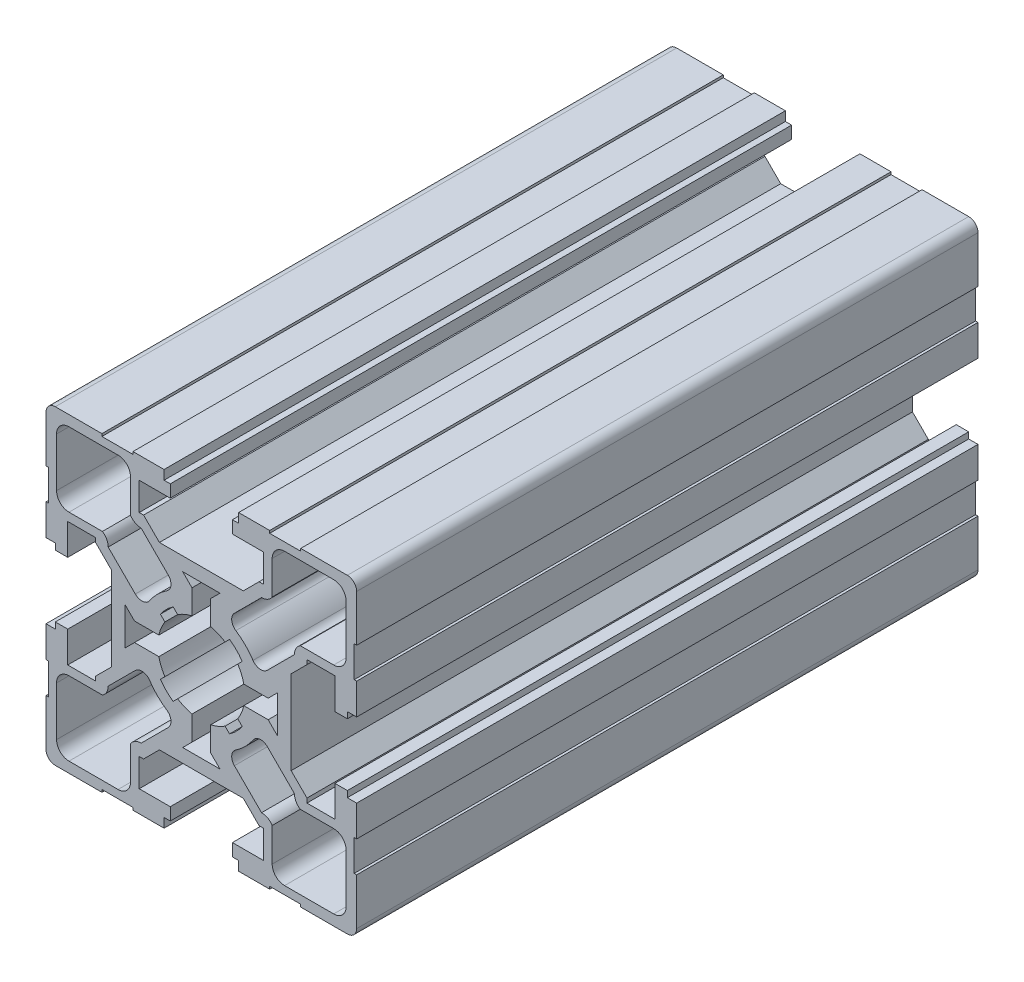
from build123d import *

# Parameters (mm, degrees)
EXTRUDE_1_DEPTH = 100


with BuildPart() as part:
    # 草图1 → 凸台-拉伸1 (new body)
    with BuildSketch(Plane.XY):
        with BuildLine():
            Line((-5.877197952, 24.545792426), (-10.877197952, 24.545792426))
            Line((-10.877197952, 24.545792426), (-10.877197952, 24.145792426))
            Line((-10.877197952, 24.145792426), (-15.877197952, 24.145792426))
            Line((-15.877197952, 24.145792426), (-15.877197952, 24.545792426))
            Line((-15.877197952, 24.545792426), (-23.377197952, 24.545792426))
            ThreePointArc((-23.377197952, 24.545792426), (-24.437858124, 24.106452598), (-24.877197952, 23.045792426))
            Line((-24.877197952, 23.045792426), (-24.877197952, 15.545792426))
            Line((-24.877197952, 15.545792426), (-24.477197952, 15.545792426))
            Line((-24.477197952, 15.545792426), (-24.477197952, 10.545792426))
            Line((-24.477197952, 10.545792426), (-24.877197952, 10.545792426))
            Line((-24.877197952, 10.545792426), (-24.877197952, 5.545792426))
            Line((-24.877197952, 5.545792426), (-23.377197952, 5.545792426))
            Line((-23.377197952, 5.545792426), (-23.377197952, 4.545792426))
            Line((-23.377197952, 4.545792426), (-21.377197952, 4.545792426))
            Line((-21.377197952, 4.545792426), (-21.377197952, 9.545792426))
            Line((-21.377197952, 9.545792426), (-16.877197952, 9.545792426))
            Line((-16.877197952, 9.545792426), (-16.877197952, 8.84162937))
            Line((-16.877197952, 8.84162937), (-14.331361008, 6.295792426))
            Line((-14.331361008, 6.295792426), (-14.331361008, -0.454207574))
            Line((-14.331361008, -0.454207574), (-14.331361008, -7.204207574))
            Line((-14.331361008, -7.204207574), (-16.877197952, -9.750044518))
            Line((-16.877197952, -9.750044518), (-16.877197952, -10.454207574))
            Line((-16.877197952, -10.454207574), (-21.377197952, -10.454207574))
            Line((-21.377197952, -10.454207574), (-21.377197952, -5.454207574))
            Line((-21.377197952, -5.454207574), (-23.377197952, -5.454207574))
            Line((-23.377197952, -5.454207574), (-23.377197952, -6.454207574))
            Line((-23.377197952, -6.454207574), (-24.877197952, -6.454207574))
            Line((-24.877197952, -6.454207574), (-24.877197952, -11.454207574))
            Line((-24.877197952, -11.454207574), (-24.477197952, -11.454207574))
            Line((-24.477197952, -11.454207574), (-24.477197952, -16.454207574))
            Line((-24.477197952, -16.454207574), (-24.877197952, -16.454207574))
            Line((-24.877197952, -16.454207574), (-24.877197952, -23.954207574))
            ThreePointArc((-24.877197952, -23.954207574), (-24.437858124, -25.014867745), (-23.377197952, -25.454207574))
            Line((-23.377197952, -25.454207574), (-15.877197952, -25.454207574))
            Line((-15.877197952, -25.454207574), (-15.877197952, -25.054207574))
            Line((-15.877197952, -25.054207574), (-10.877197952, -25.054207574))
            Line((-10.877197952, -25.054207574), (-10.877197952, -25.454207574))
            Line((-10.877197952, -25.454207574), (-5.877197952, -25.454207574))
            Line((-5.877197952, -25.454207574), (-5.877197952, -23.954207574))
            Line((-5.877197952, -23.954207574), (-4.877197952, -23.954207574))
            Line((-4.877197952, -23.954207574), (-4.877197952, -21.954207574))
            Line((-4.877197952, -21.954207574), (-9.877197952, -21.954207574))
            Line((-9.877197952, -21.954207574), (-9.877197952, -17.454207574))
            Line((-9.877197952, -17.454207574), (-9.173034896, -17.454207574))
            Line((-9.173034896, -17.454207574), (-6.627197952, -14.90837063))
            Line((-6.627197952, -14.90837063), (0.122802048, -14.90837063))
            Line((0.122802048, -14.90837063), (6.872802048, -14.90837063))
            Line((6.872802048, -14.90837063), (9.418638992, -17.454207574))
            Line((9.418638992, -17.454207574), (10.122802048, -17.454207574))
            Line((10.122802048, -17.454207574), (10.122802048, -21.954207574))
            Line((10.122802048, -21.954207574), (5.122802048, -21.954207574))
            Line((5.122802048, -21.954207574), (5.122802048, -23.954207574))
            Line((5.122802048, -23.954207574), (6.122802048, -23.954207574))
            Line((6.122802048, -23.954207574), (6.122802048, -25.454207574))
            Line((6.122802048, -25.454207574), (11.122802048, -25.454207574))
            Line((11.122802048, -25.454207574), (11.122802048, -25.054207574))
            Line((11.122802048, -25.054207574), (16.122802048, -25.054207574))
            Line((16.122802048, -25.054207574), (16.122802048, -25.454207574))
            Line((16.122802048, -25.454207574), (23.622802048, -25.454207574))
            ThreePointArc((23.622802048, -25.454207574), (24.683462219, -25.014867745), (25.122802048, -23.954207574))
            Line((25.122802048, -23.954207574), (25.122802048, -16.454207574))
            Line((25.122802048, -16.454207574), (24.722802048, -16.454207574))
            Line((24.722802048, -16.454207574), (24.722802048, -11.454207574))
            Line((24.722802048, -11.454207574), (25.122802048, -11.454207574))
            Line((25.122802048, -11.454207574), (25.122802048, -6.454207574))
            Line((25.122802048, -6.454207574), (23.622802048, -6.454207574))
            Line((23.622802048, -6.454207574), (23.622802048, -5.454207574))
            Line((23.622802048, -5.454207574), (21.622802048, -5.454207574))
            Line((21.622802048, -5.454207574), (21.622802048, -10.454207574))
            Line((21.622802048, -10.454207574), (17.122802048, -10.454207574))
            Line((17.122802048, -10.454207574), (17.122802048, -9.750044518))
            Line((17.122802048, -9.750044518), (14.576965104, -7.204207574))
            Line((14.576965104, -7.204207574), (14.576965104, -0.454207574))
            Line((14.576965104, -0.454207574), (14.576965104, 6.295792426))
            Line((14.576965104, 6.295792426), (17.122802048, 8.84162937))
            Line((17.122802048, 8.84162937), (17.122802048, 9.545792426))
            Line((17.122802048, 9.545792426), (21.622802048, 9.545792426))
            Line((21.622802048, 9.545792426), (21.622802048, 4.545792426))
            Line((21.622802048, 4.545792426), (23.622802048, 4.545792426))
            Line((23.622802048, 4.545792426), (23.622802048, 5.545792426))
            Line((23.622802048, 5.545792426), (25.122802048, 5.545792426))
            Line((25.122802048, 5.545792426), (25.122802048, 10.545792426))
            Line((25.122802048, 10.545792426), (24.722802048, 10.545792426))
            Line((24.722802048, 10.545792426), (24.722802048, 15.545792426))
            Line((24.722802048, 15.545792426), (25.122802048, 15.545792426))
            Line((25.122802048, 15.545792426), (25.122802048, 23.045792426))
            ThreePointArc((25.122802048, 23.045792426), (24.683462219, 24.106452598), (23.622802048, 24.545792426))
            Line((23.622802048, 24.545792426), (16.122802048, 24.545792426))
            Line((16.122802048, 24.545792426), (16.122802048, 24.145792426))
            Line((16.122802048, 24.145792426), (11.122802048, 24.145792426))
            Line((11.122802048, 24.145792426), (11.122802048, 24.545792426))
            Line((11.122802048, 24.545792426), (6.122802048, 24.545792426))
            Line((6.122802048, 24.545792426), (6.122802048, 23.045792426))
            Line((6.122802048, 23.045792426), (5.122802048, 23.045792426))
            Line((5.122802048, 23.045792426), (5.122802048, 21.045792426))
            Line((5.122802048, 21.045792426), (10.122802048, 21.045792426))
            Line((10.122802048, 21.045792426), (10.122802048, 16.545792426))
            Line((10.122802048, 16.545792426), (9.418638992, 16.545792426))
            Line((9.418638992, 16.545792426), (6.872802048, 13.999955482))
            Line((6.872802048, 13.999955482), (0.122802048, 13.999955482))
            Line((0.122802048, 13.999955482), (-6.627197952, 13.999955482))
            Line((-6.627197952, 13.999955482), (-9.173034896, 16.545792426))
            Line((-9.173034896, 16.545792426), (-9.877197952, 16.545792426))
            Line((-9.877197952, 16.545792426), (-9.877197952, 21.045792426))
            Line((-9.877197952, 21.045792426), (-4.877197952, 21.045792426))
            Line((-4.877197952, 21.045792426), (-4.877197952, 23.045792426))
            Line((-4.877197952, 23.045792426), (-5.877197952, 23.045792426))
            Line((-5.877197952, 23.045792426), (-5.877197952, 24.545792426))
        make_face()
        with BuildLine():
            Line((-11.277197952, 15.470392021), (-11.277197952, 20.845792426))
            ThreePointArc((-11.277197952, 20.845792426), (-11.86298439, 22.260005989), (-13.277197952, 22.845792426))
            Line((-13.277197952, 22.845792426), (-21.177197952, 22.845792426))
            ThreePointArc((-21.177197952, 22.845792426), (-22.591411515, 22.260005989), (-23.177197952, 20.845792426))
            Line((-23.177197952, 20.845792426), (-23.177197952, 12.945792426))
            ThreePointArc((-23.177197952, 12.945792426), (-22.591411515, 11.531578864), (-21.177197952, 10.945792426))
            Line((-21.177197952, 10.945792426), (-15.801797547, 10.945792426))
            ThreePointArc((-15.801797547, 10.945792426), (-15.113487823, 10.212778243), (-14.868867851, 9.237462325))
            Line((-14.868867851, 9.237462325), (-10.502096003, 4.870690477))
            ThreePointArc((-10.502096003, 4.870690477), (-9.294136993, 4.438600484), (-8.193926542, 5.09845175))
            ThreePointArc((-8.193926542, 5.09845175), (-6.948265764, 6.616860238), (-5.429857276, 7.862521016))
            ThreePointArc((-5.429857276, 7.862521016), (-4.77000601, 8.962731467), (-5.202096003, 10.170690477))
            Line((-5.202096003, 10.170690477), (-9.568867851, 14.537462325))
            ThreePointArc((-9.568867851, 14.537462325), (-10.544183769, 14.782082297), (-11.277197952, 15.470392021))
        make_face(mode=Mode.SUBTRACT)
        with BuildLine():
            Line((-5.744893723, 3.362878532), (-6.465662858, 4.083647667))
            ThreePointArc((-6.465662858, 4.083647667), (-5.534052202, 5.202646676), (-4.415053193, 6.134257332))
            Line((-4.415053193, 6.134257332), (-3.694284058, 5.413488197))
            ThreePointArc((-3.694284058, 5.413488197), (-2.579591588, 6.003119167), (-1.377197952, 6.383189592))
            Line((-1.377197952, 6.383189592), (-1.377197952, 10.301304753))
            Line((-1.377197952, 10.301304753), (-2.877197952, 11.801304753))
            Line((-2.877197952, 11.801304753), (0.122802048, 11.801304753))
            Line((0.122802048, 11.801304753), (3.122802048, 11.801304753))
            Line((3.122802048, 11.801304753), (1.622802048, 10.301304753))
            Line((1.622802048, 10.301304753), (1.622802048, 6.383189592))
            ThreePointArc((1.622802048, 6.383189592), (2.825195683, 6.003119167), (3.939888153, 5.413488197))
            Line((3.939888153, 5.413488197), (4.660657288, 6.134257332))
            ThreePointArc((4.660657288, 6.134257332), (5.779656297, 5.202646676), (6.711266954, 4.083647667))
            Line((6.711266954, 4.083647667), (5.990497819, 3.362878532))
            ThreePointArc((5.990497819, 3.362878532), (6.580128788, 2.248186062), (6.960199213, 1.045792426))
            Line((6.960199213, 1.045792426), (10.878314375, 1.045792426))
            Line((10.878314375, 1.045792426), (12.378314375, 2.545792426))
            Line((12.378314375, 2.545792426), (12.378314375, -0.454207574))
            Line((12.378314375, -0.454207574), (12.378314375, -3.454207574))
            Line((12.378314375, -3.454207574), (10.878314375, -1.954207574))
            Line((10.878314375, -1.954207574), (6.960199213, -1.954207574))
            ThreePointArc((6.960199213, -1.954207574), (6.580128788, -3.156601209), (5.990497819, -4.271293679))
            Line((5.990497819, -4.271293679), (6.711266954, -4.992062814))
            ThreePointArc((6.711266954, -4.992062814), (5.779656297, -6.111061823), (4.660657288, -7.04267248))
            Line((4.660657288, -7.04267248), (3.939888153, -6.321903345))
            ThreePointArc((3.939888153, -6.321903345), (2.825195683, -6.911534314), (1.622802048, -7.291604739))
            Line((1.622802048, -7.291604739), (1.622802048, -11.209719901))
            Line((1.622802048, -11.209719901), (3.122802048, -12.709719901))
            Line((3.122802048, -12.709719901), (0.122802048, -12.709719901))
            Line((0.122802048, -12.709719901), (-2.877197952, -12.709719901))
            Line((-2.877197952, -12.709719901), (-1.377197952, -11.209719901))
            Line((-1.377197952, -11.209719901), (-1.377197952, -7.291604739))
            ThreePointArc((-1.377197952, -7.291604739), (-2.579591588, -6.911534314), (-3.694284058, -6.321903345))
            Line((-3.694284058, -6.321903345), (-4.415053193, -7.04267248))
            ThreePointArc((-4.415053193, -7.04267248), (-5.534052202, -6.111061823), (-6.465662858, -4.992062814))
            Line((-6.465662858, -4.992062814), (-5.744893723, -4.271293679))
            ThreePointArc((-5.744893723, -4.271293679), (-6.334524693, -3.156601209), (-6.714595118, -1.954207574))
            Line((-6.714595118, -1.954207574), (-10.632710279, -1.954207574))
            Line((-10.632710279, -1.954207574), (-12.132710279, -3.454207574))
            Line((-12.132710279, -3.454207574), (-12.132710279, -0.454207574))
            Line((-12.132710279, -0.454207574), (-12.132710279, 2.545792426))
            Line((-12.132710279, 2.545792426), (-10.632710279, 1.045792426))
            Line((-10.632710279, 1.045792426), (-6.714595118, 1.045792426))
            ThreePointArc((-6.714595118, 1.045792426), (-6.334524693, 2.248186062), (-5.744893723, 3.362878532))
        make_face(mode=Mode.SUBTRACT)
        with BuildLine():
            Line((11.522802048, 15.470392021), (11.522802048, 20.845792426))
            ThreePointArc((11.522802048, 20.845792426), (12.108588485, 22.260005989), (13.522802048, 22.845792426))
            Line((13.522802048, 22.845792426), (21.422802048, 22.845792426))
            ThreePointArc((21.422802048, 22.845792426), (22.83701561, 22.260005989), (23.422802048, 20.845792426))
            Line((23.422802048, 20.845792426), (23.422802048, 12.945792426))
            ThreePointArc((23.422802048, 12.945792426), (22.83701561, 11.531578864), (21.422802048, 10.945792426))
            Line((21.422802048, 10.945792426), (16.047401643, 10.945792426))
            ThreePointArc((16.047401643, 10.945792426), (15.359091918, 10.212778243), (15.114471947, 9.237462325))
            Line((15.114471947, 9.237462325), (10.747700098, 4.870690477))
            ThreePointArc((10.747700098, 4.870690477), (9.539741089, 4.438600484), (8.439530638, 5.09845175))
            ThreePointArc((8.439530638, 5.09845175), (7.19386986, 6.616860238), (5.675461371, 7.862521016))
            ThreePointArc((5.675461371, 7.862521016), (5.015610105, 8.962731467), (5.447700098, 10.170690477))
            Line((5.447700098, 10.170690477), (9.814471947, 14.537462325))
            ThreePointArc((9.814471947, 14.537462325), (10.789787864, 14.782082297), (11.522802048, 15.470392021))
        make_face(mode=Mode.SUBTRACT)
        with BuildLine():
            Line((-11.277197952, -16.378807169), (-11.277197952, -21.754207574))
            ThreePointArc((-11.277197952, -21.754207574), (-11.86298439, -23.168421136), (-13.277197952, -23.754207574))
            Line((-13.277197952, -23.754207574), (-21.177197952, -23.754207574))
            ThreePointArc((-21.177197952, -23.754207574), (-22.591411515, -23.168421136), (-23.177197952, -21.754207574))
            Line((-23.177197952, -21.754207574), (-23.177197952, -13.854207574))
            ThreePointArc((-23.177197952, -13.854207574), (-22.591411515, -12.439994011), (-21.177197952, -11.854207574))
            Line((-21.177197952, -11.854207574), (-15.801797547, -11.854207574))
            ThreePointArc((-15.801797547, -11.854207574), (-15.113487823, -11.12119339), (-14.868867851, -10.145877473))
            Line((-14.868867851, -10.145877473), (-10.502096003, -5.779105624))
            ThreePointArc((-10.502096003, -5.779105624), (-9.294136993, -5.347015631), (-8.193926542, -6.006866897))
            ThreePointArc((-8.193926542, -6.006866897), (-6.948265764, -7.525275386), (-5.429857276, -8.770936164))
            ThreePointArc((-5.429857276, -8.770936164), (-4.77000601, -9.871146615), (-5.202096003, -11.079105624))
            Line((-5.202096003, -11.079105624), (-9.568867851, -15.445877473))
            ThreePointArc((-9.568867851, -15.445877473), (-10.544183769, -15.690497444), (-11.277197952, -16.378807169))
        make_face(mode=Mode.SUBTRACT)
        with BuildLine():
            Line((11.522802048, -16.378807169), (11.522802048, -21.754207574))
            ThreePointArc((11.522802048, -21.754207574), (12.108588485, -23.168421136), (13.522802048, -23.754207574))
            Line((13.522802048, -23.754207574), (21.422802048, -23.754207574))
            ThreePointArc((21.422802048, -23.754207574), (22.83701561, -23.168421136), (23.422802048, -21.754207574))
            Line((23.422802048, -21.754207574), (23.422802048, -13.854207574))
            ThreePointArc((23.422802048, -13.854207574), (22.83701561, -12.439994011), (21.422802048, -11.854207574))
            Line((21.422802048, -11.854207574), (16.047401643, -11.854207574))
            ThreePointArc((16.047401643, -11.854207574), (15.359091918, -11.12119339), (15.114471947, -10.145877473))
            Line((15.114471947, -10.145877473), (10.747700098, -5.779105624))
            ThreePointArc((10.747700098, -5.779105624), (9.539741089, -5.347015631), (8.439530638, -6.006866897))
            ThreePointArc((8.439530638, -6.006866897), (7.19386986, -7.525275386), (5.675461371, -8.770936164))
            ThreePointArc((5.675461371, -8.770936164), (5.015610105, -9.871146615), (5.447700098, -11.079105624))
            Line((5.447700098, -11.079105624), (9.814471947, -15.445877473))
            ThreePointArc((9.814471947, -15.445877473), (10.789787864, -15.690497444), (11.522802048, -16.378807169))
        make_face(mode=Mode.SUBTRACT)
    extrude(amount=EXTRUDE_1_DEPTH)


solid = part.part
